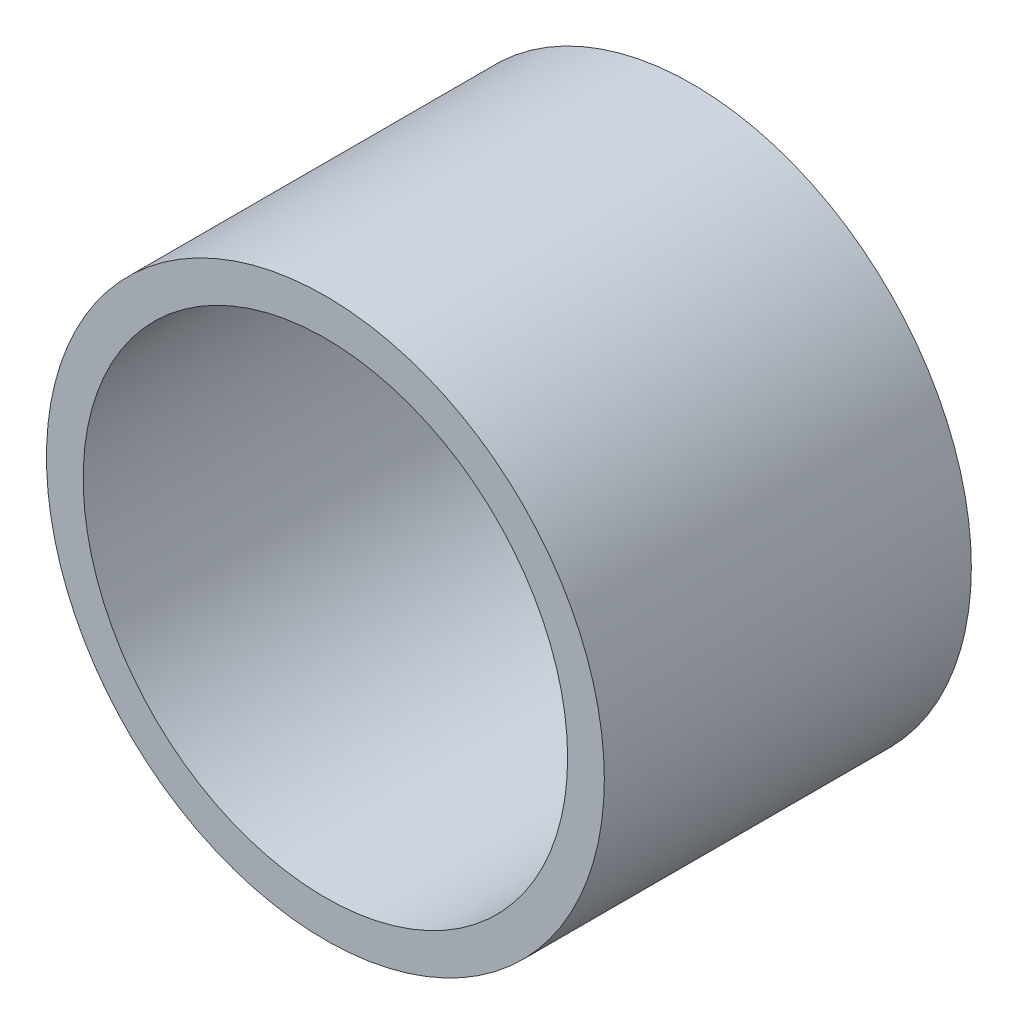
from build123d import *

# Parameters (mm, degrees)
SKETCH_1_R      = 1.9
SKETCH_1_R_2    = 1.65
EXTRUDE_1_DEPTH = 2.5


with BuildPart() as part:
    # ｽｹｯﾁ1 → ﾎﾞｽ - 押し出し1 (new body)
    with BuildSketch(Plane.XY):
        Circle(SKETCH_1_R)
        Circle(SKETCH_1_R_2, mode=Mode.SUBTRACT)
    extrude(amount=EXTRUDE_1_DEPTH)


solid = part.part
